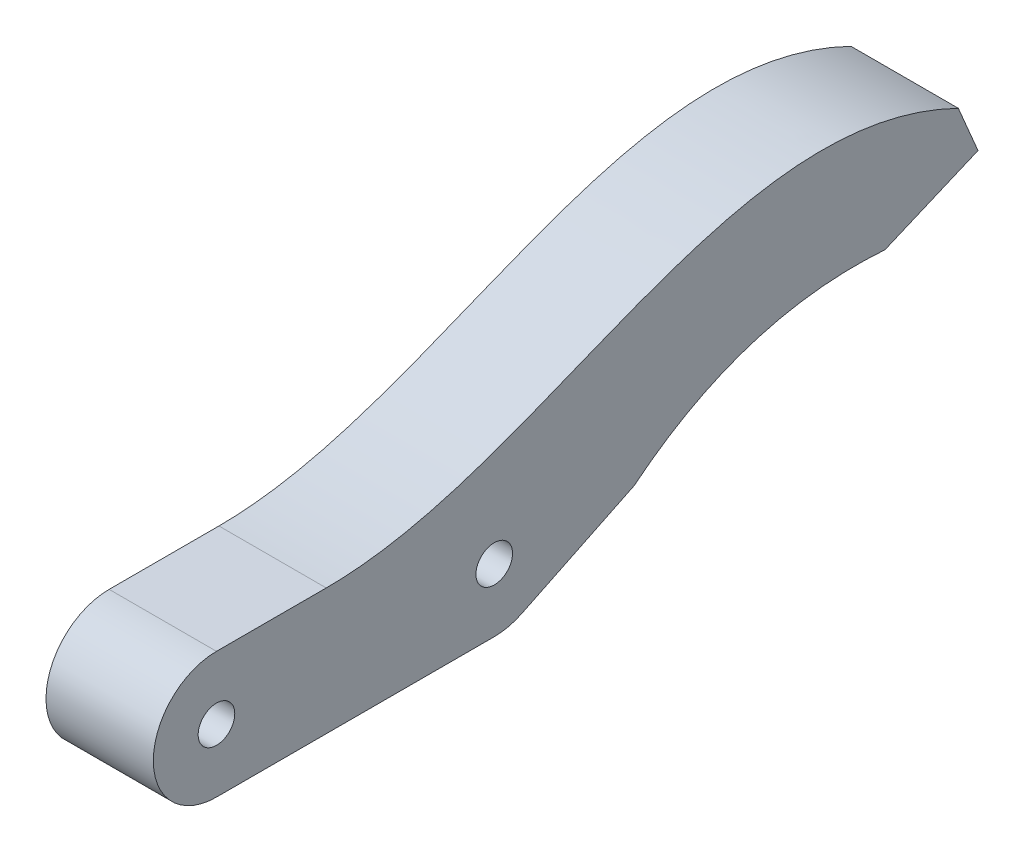
from build123d import *

# Parameters (mm, degrees)
SKETCH1_R           = 1.45
BOSS_EXTRUDE1_DEPTH = 8.5
BOSS_EXTRUDE2_START = -8.5
BOSS_EXTRUDE2_DEPTH = 8.5


with BuildPart() as part:
    # Sketch1 → Boss-Extrude1 (new body)
    with BuildSketch(Plane(origin=(0, 0, 0), x_dir=(0, 0, -1), z_dir=(1, 0, 0))):
        with BuildLine():
            Line((27, 10), (5, 10))
            ThreePointArc((5, 10), (0, 5), (5, 0))
            Line((5, 0), (27, 0))
            ThreePointArc((27, 0), (32, 5), (27, 10))
        make_face()
        with Locations((5, 5)):
            Circle(SKETCH1_R, mode=Mode.SUBTRACT)
        with Locations((27, 5)):
            Circle(SKETCH1_R, mode=Mode.SUBTRACT)
    extrude(amount=BOSS_EXTRUDE1_DEPTH)

    # Sketch2 → Boss-Extrude2 (add)
    with BuildSketch(Plane(origin=(8.5, 0, 0), x_dir=(0, 0, -1), z_dir=(1, 0, 0)).offset(BOSS_EXTRUDE2_START)):
        with BuildLine():
            add(Edge.make_bspline(
                [(63.752972286, 17.872423117), (45.928882678, 26.563787963), (31.059268621, 10), (13.694974759, 10)],
                knots=[0, 0, 0, 0, 1, 1, 1, 1], degree=3))
            Line((13.694974759, 10), (27, 10))
            ThreePointArc((27, 10), (31.87285141, 6.120410255), (29.183837075, 0.502127655))
            Line((29.183837075, 0.502127655), (38.08542066, 4.824084077))
            add(Edge.make_bspline(
                [(38.08542066, 4.824084077), (46.797509509, 11.895222457), (57.948000409, 11.067843667)],
                knots=[0, 0, 0, 1, 1, 1], degree=2))
            Line((57.948000409, 11.067843667), (65.313809691, 14.189518476))
            Line((65.313809691, 14.189518476), (63.752972286, 17.872423117))
        make_face()
    extrude(amount=BOSS_EXTRUDE2_DEPTH)


solid = part.part
